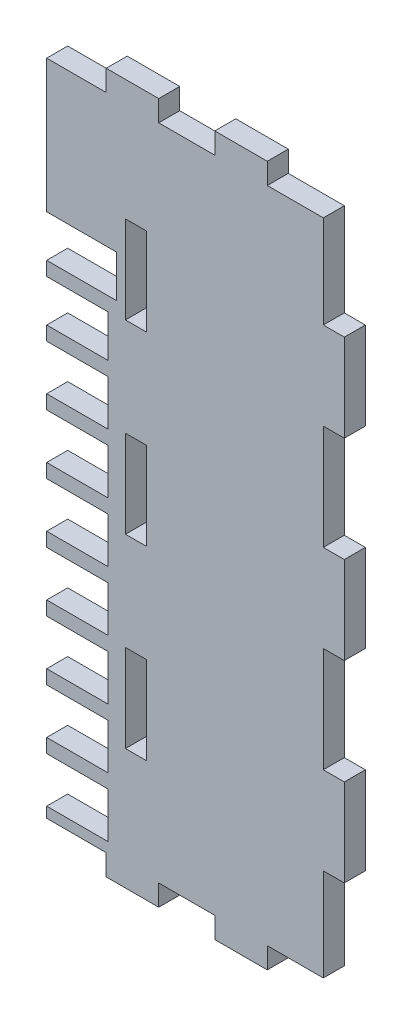
from build123d import *

# Parameters (mm, degrees)
ESQUISSE1_W             = 79
ESQUISSE1_H             = 188
BOSS_EXTRU_1_DEPTH      = 6
ESQUISSE2_W             = 20
ESQUISSE2_H             = 12
ESQUISSE2_W_2           = 17.5
ESQUISSE2_H_2           = 13
ENL_V_MAT_EXTRU_1_DEPTH = 10
ESQUISSE3_W             = 6
ESQUISSE3_H             = 25
BOSS_EXTRU_2_DEPTH      = 6
ESQUISSE4_W             = 15
ESQUISSE4_H             = 6
BOSS_EXTRU_3_DEPTH      = 6
ESQUISSE5_W             = 15
ESQUISSE5_H             = 6
BOSS_EXTRU_4_DEPTH      = 6
ESQUISSE6_W             = 6
ESQUISSE6_H             = 25
ESQUISSE6_W_2           = 5.984999771
ESQUISSE6_W_3           = 6.000000529
ENL_V_MAT_EXTRU_2_DEPTH = 10


with BuildPart() as part:
    # Esquisse1 → Boss.-Extru.1 (new body)
    with BuildSketch(Plane.XY):
        Rectangle(ESQUISSE1_W, ESQUISSE1_H)
    extrude(amount=BOSS_EXTRU_1_DEPTH)

    # Esquisse2 → Enlèv. mat.-Extru.1 (cut)
    with BuildSketch(Plane.XY.offset(6)):
        with Locations((-29.5, 50)):
            Rectangle(ESQUISSE2_W, ESQUISSE2_H)
        with Locations((-30.75, 34)):
            Rectangle(ESQUISSE2_W_2, ESQUISSE2_H)
        with Locations((-30.75, 17.5)):
            Rectangle(ESQUISSE2_W_2, ESQUISSE2_H_2)
        with Locations((-30.75, 0.5)):
            Rectangle(ESQUISSE2_W_2, ESQUISSE2_H_2)
        with Locations((-30.75, -16.5)):
            Rectangle(ESQUISSE2_W_2, ESQUISSE2_H_2)
        with Locations((-30.75, -33.5)):
            Rectangle(ESQUISSE2_W_2, ESQUISSE2_H_2)
        with Locations((-30.75, -50.5)):
            Rectangle(ESQUISSE2_W_2, ESQUISSE2_H_2)
        with Locations((-30.75, -67.5)):
            Rectangle(ESQUISSE2_W_2, ESQUISSE2_H_2)
        with Locations((-30.75, -84.5)):
            Rectangle(ESQUISSE2_W_2, ESQUISSE2_H_2)
    extrude(amount=-ENL_V_MAT_EXTRU_1_DEPTH, mode=Mode.SUBTRACT)

    # Esquisse3 → Boss.-Extru.2 (add)
    with BuildSketch(Plane(origin=(39.5, 0, 0), x_dir=(0, 0, -1), z_dir=(1, 0, 0))):
        with Locations((-3, 55)):
            Rectangle(ESQUISSE3_W, ESQUISSE3_H)
        with Locations((-3, 0)):
            Rectangle(ESQUISSE3_W, ESQUISSE3_H)
        with Locations((-3, -55)):
            Rectangle(ESQUISSE3_W, ESQUISSE3_H)
    extrude(amount=BOSS_EXTRU_2_DEPTH)

    # Esquisse4 → Boss.-Extru.3 (add)
    with BuildSketch(Plane(origin=(0, 94, 0), x_dir=(1, 0, 0), z_dir=(0, 1, 0))):
        with Locations((-15, -3)):
            Rectangle(ESQUISSE4_W, ESQUISSE4_H)
        with Locations((16, -3)):
            Rectangle(ESQUISSE4_W, ESQUISSE4_H)
    extrude(amount=BOSS_EXTRU_3_DEPTH)

    # Esquisse5 → Boss.-Extru.4 (add)
    with BuildSketch(Plane.XZ.offset(94)):
        with Locations((16, 3)):
            Rectangle(ESQUISSE5_W, ESQUISSE5_H)
        with Locations((-15, 3)):
            Rectangle(ESQUISSE5_W, ESQUISSE5_H)
    extrude(amount=BOSS_EXTRU_4_DEPTH)

    # Esquisse6 → Enlèv. mat.-Extru.2 (cut)
    with BuildSketch(Plane(origin=(0, 0, 0), x_dir=(-1, 0, 0), z_dir=(0, 0, -1))):
        with Locations((14, -53)):
            Rectangle(ESQUISSE6_W, ESQUISSE6_H)
        with Locations((14.007500115, -4.018e-06)):
            Rectangle(ESQUISSE6_W_2, ESQUISSE6_H)
        with Locations((13.999999736, 52.999991964)):
            Rectangle(ESQUISSE6_W_3, ESQUISSE6_H)
    extrude(amount=-ENL_V_MAT_EXTRU_2_DEPTH, mode=Mode.SUBTRACT)


solid = part.part
